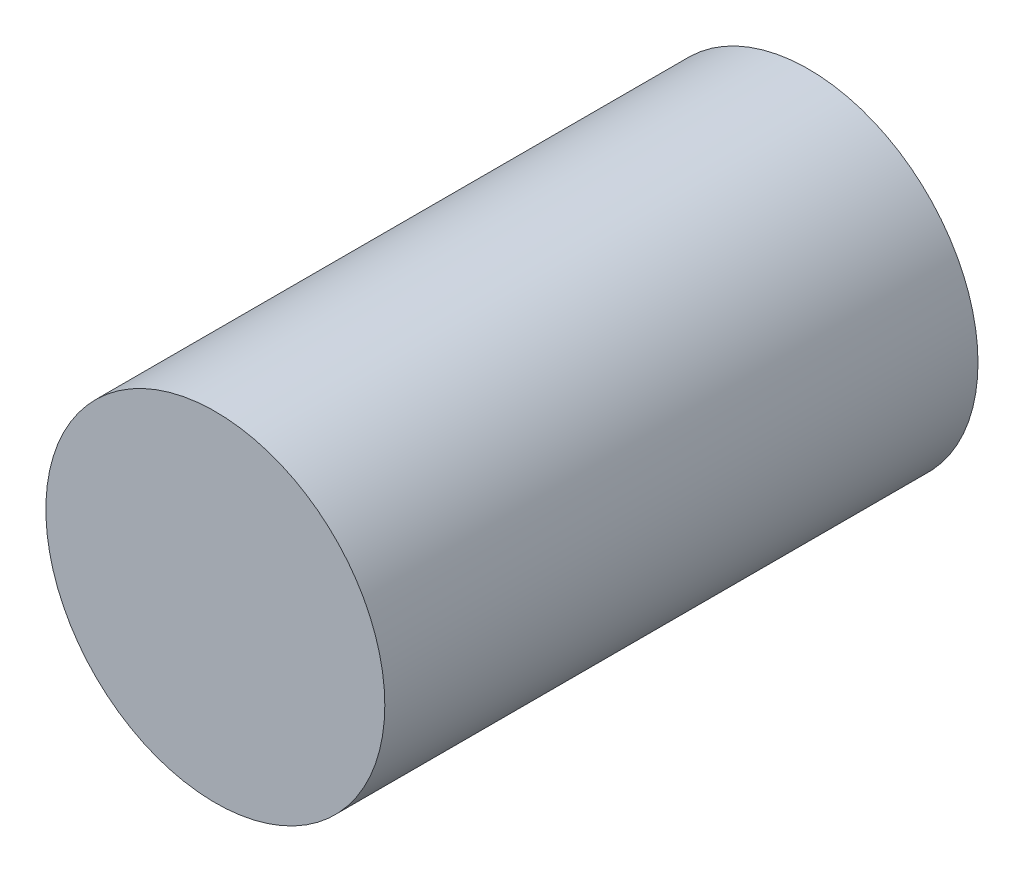
from build123d import *

# Parameters (mm, degrees)
SKETCH1_R     = 2
PROFILE_DEPTH = 7


with BuildPart() as part:
    # Sketch1 → Profile (new body)
    with BuildSketch(Plane.XY):
        with Locations((2, 2)):
            Circle(SKETCH1_R)
    extrude(amount=PROFILE_DEPTH)


solid = part.part
